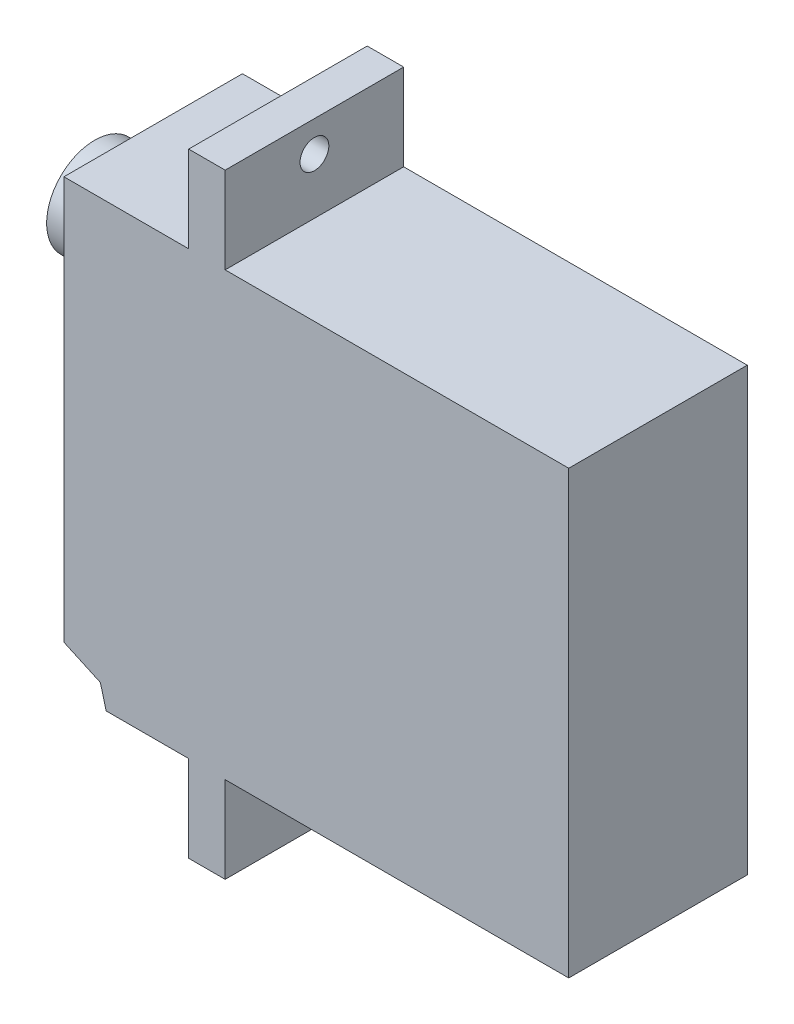
from build123d import *

# Parameters (mm, degrees)
BOSS_EXTRUDE1_DEPTH     = 4.65
CUT_EXTRUDE4_DEPTH      = 22.226045322
CUT_EXTRUDE4_DEPTH_BACK = 22.226045322
SKETCH3_W               = 3.05
SKETCH3_H               = 2.5
SKETCH4_R               = 0.75
CUT_EXTRUDE1_DEPTH      = 10


with BuildPart() as part:
    # Sketch1 → Boss-Extrude1 (new, symmetric)
    with BuildSketch(Plane.XY):
        Polygon((-4.75, 11.5), (-4.75, 16), (-6.65, 16), (-6.65, 11.5), (-13.15, 11.5), (-13.15, -9.5), (-13.15, -11.5), (-10.95, -11.5), (-6.65, -11.5), (-6.65, -16), (-4.75, -16), (-4.75, -11.5), (13.15, -11.5), (13.15, 11.5), align=None)
    extrude(amount=BOSS_EXTRUDE1_DEPTH, both=True)

    # Sketch7 → Cut-Extrude4 (cut, two sides: drawn at the far end of the back side and taken through both)
    with BuildSketch(Plane.XY.offset(-CUT_EXTRUDE4_DEPTH_BACK)):
        Polygon((-11.251215972, -10.366937752), (-13.15, -9.5), (-13.15, -11.5), (-10.95, -11.5), align=None)
    extrude(amount=CUT_EXTRUDE4_DEPTH + CUT_EXTRUDE4_DEPTH_BACK, mode=Mode.SUBTRACT)

    # Sketch3 → Revolve1 (revolve)
    with BuildSketch(Plane.XY, mode=Mode.PRIVATE) as revolve1_sk:
        with Locations((-14.675, 8.05)):
            Rectangle(SKETCH3_W, SKETCH3_H)
    revolve(revolve1_sk.sketch.rotate(Axis((-13.15, 6.8, 0), (-1, 0, 0)), 90), axis=Axis((-13.15, 6.8, 0), (-1, 0, 0)))

    # Sketch4 → Cut-Extrude1 (cut)
    with BuildSketch(Plane.ZY.offset(6.65)):
        with Locations(Location((0, 14.4, 0), (0, 0, 270))):
            Circle(SKETCH4_R)
        with Locations(Location((0, -14.4, 0), (0, 0, 270))):
            Circle(SKETCH4_R)
    extrude(amount=-CUT_EXTRUDE1_DEPTH, mode=Mode.SUBTRACT)


solid = part.part
